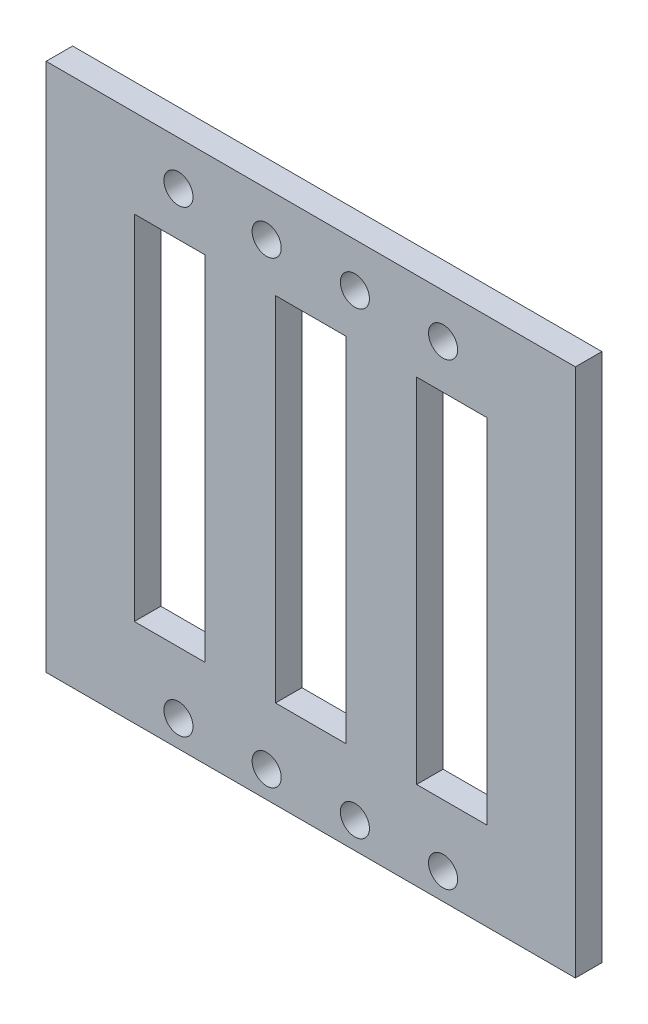
from build123d import *

# Parameters (mm, degrees)
ESQUISSE1_W             = 60
ESQUISSE1_H             = 60
ESQUISSE1_R             = 1.65
BOSS_EXTRU_1_DEPTH      = 3
ESQUISSE2_W             = 8
ESQUISSE2_H             = 40
ENL_V_MAT_EXTRU_1_DEPTH = 3


with BuildPart() as part:
    # Esquisse1 → Boss.-Extru.1 (new body)
    with BuildSketch(Plane.XY):
        Rectangle(ESQUISSE1_W, ESQUISSE1_H)
        with Locations((-15, 25)):
            Circle(ESQUISSE1_R, mode=Mode.SUBTRACT)
        with Locations((5, 25)):
            Circle(ESQUISSE1_R, mode=Mode.SUBTRACT)
        with Locations((15, 25)):
            Circle(ESQUISSE1_R, mode=Mode.SUBTRACT)
        with Locations((-5, 25)):
            Circle(ESQUISSE1_R, mode=Mode.SUBTRACT)
        with Locations((-15, -27)):
            Circle(ESQUISSE1_R, mode=Mode.SUBTRACT)
        with Locations((-5, -27)):
            Circle(ESQUISSE1_R, mode=Mode.SUBTRACT)
        with Locations((5, -27)):
            Circle(ESQUISSE1_R, mode=Mode.SUBTRACT)
        with Locations((15, -27)):
            Circle(ESQUISSE1_R, mode=Mode.SUBTRACT)
    extrude(amount=-BOSS_EXTRU_1_DEPTH)

    # Esquisse2 → Enlèv. mat.-Extru.1 (cut)
    with BuildSketch(Plane.XY):
        with Locations((-16, 0)):
            Rectangle(ESQUISSE2_W, ESQUISSE2_H)
        Rectangle(ESQUISSE2_W, ESQUISSE2_H)
        with Locations((16, 0)):
            Rectangle(ESQUISSE2_W, ESQUISSE2_H)
    extrude(amount=-ENL_V_MAT_EXTRU_1_DEPTH, mode=Mode.SUBTRACT)


solid = part.part
